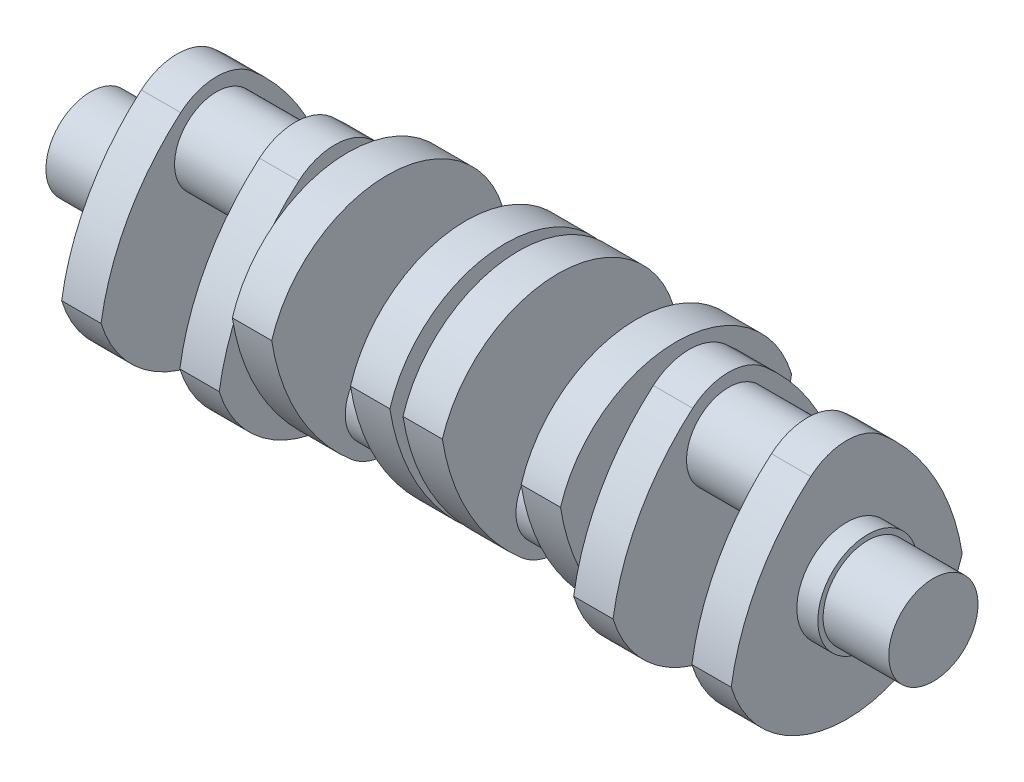
from build123d import *

# Parameters (mm, degrees)
SKETCH1_R            = 17
BOSS_EXTRUDE1_DEPTH  = 25
SKETCH1_6_R          = 19
BOSS_EXTRUDE5_DEPTH  = 8
BOSS_EXTRUDE6_DEPTH  = 15
SKETCH4_R            = 16
BOSS_EXTRUDE7_DEPTH  = 15
BOSS_EXTRUDE8_START  = 5
SKETCH5_R            = 17
BOSS_EXTRUDE8_DEPTH  = 5
BOSS_EXTRUDE9_DEPTH  = 15
SKETCH8_R            = 16
BOSS_EXTRUDE10_DEPTH = 30
BOSS_EXTRUDE11_DEPTH = 15
BOSS_EXTRUDE12_START = 2.5
SKETCH10_R           = 17
BOSS_EXTRUDE12_DEPTH = 2.5


with BuildPart() as part:
    # Sketch1 → Boss-Extrude1 (new body)
    with BuildSketch(Plane(origin=(0, 0, 0), x_dir=(0, 0, -1), z_dir=(1, 0, 0))):
        Circle(SKETCH1_R)
    extrude(amount=-BOSS_EXTRUDE1_DEPTH)

    # Sketch1<6> → Boss-Extrude5 (add)
    with BuildSketch(Plane(origin=(0, 0, 0), x_dir=(0, 0, -1), z_dir=(1, 0, 0))):
        Circle(SKETCH1_6_R)
    extrude(amount=BOSS_EXTRUDE5_DEPTH)

    # Sketch2 → Boss-Extrude6 (add)
    with BuildSketch(Plane(origin=(8, 0, 0), x_dir=(0, 0, -1), z_dir=(1, 0, 0))):
        with BuildLine():
            ThreePointArc((-13.668094758, 40.943123461), (0, 46), (13.668094758, 40.943123461))
            ThreePointArc((13.668094758, 40.943123461), (33.683444249, 16.469257624), (44, -13.416407865))
            ThreePointArc((44, -13.416407865), (0, -46), (-44, -13.416407865))
            ThreePointArc((-44, -13.416407865), (-33.683444249, 16.469257624), (-13.668094758, 40.943123461))
        make_face()
    boss_extrude6 = extrude(amount=BOSS_EXTRUDE6_DEPTH)

    # Sketch4 → Boss-Extrude7 (add)
    with BuildSketch(Plane(origin=(23, 0, 0), x_dir=(0, 0, -1), z_dir=(1, 0, 0))):
        with Locations((0, 25)):
            Circle(SKETCH4_R)
    boss_extrude7 = extrude(amount=BOSS_EXTRUDE7_DEPTH)

    # Mirror1: Boss-Extrude6, Boss-Extrude7 across plane
    add(boss_extrude6.mirror(Plane(origin=(38, 25, 0), x_dir=(0, 0, 1), z_dir=(1, 0, 0))))
    add(boss_extrude7.mirror(Plane(origin=(38, 25, 0), x_dir=(0, 0, 1), z_dir=(1, 0, 0))))

    # Sketch5 → Boss-Extrude8 (add)
    with BuildSketch(Plane(origin=(68, 0, 0), x_dir=(0, 0, -1), z_dir=(1, 0, 0)).offset(BOSS_EXTRUDE8_START)):
        Circle(SKETCH5_R)
    extrude(amount=-BOSS_EXTRUDE8_DEPTH)

    # Sketch7 → Boss-Extrude9 (add)
    with BuildSketch(Plane(origin=(73, 0, 0), x_dir=(0, 0, -1), z_dir=(1, 0, 0))):
        with BuildLine():
            ThreePointArc((-13.668094758, -40.943123461), (0, -46), (13.668094758, -40.943123461))
            ThreePointArc((13.668094758, -40.943123461), (33.683444249, -16.469257624), (44, 13.416407865))
            ThreePointArc((44, 13.416407865), (0, 46), (-44, 13.416407865))
            ThreePointArc((-44, 13.416407865), (-33.683444249, -16.469257624), (-13.668094758, -40.943123461))
        make_face()
    extrude(amount=BOSS_EXTRUDE9_DEPTH)

    # Sketch8 → Boss-Extrude10 (add)
    with BuildSketch(Plane(origin=(88, 0, 0), x_dir=(0, 0, -1), z_dir=(1, 0, 0))):
        with Locations((0, -25)):
            Circle(SKETCH8_R)
    extrude(amount=BOSS_EXTRUDE10_DEPTH)

    # Sketch9 → Boss-Extrude11 (add)
    with BuildSketch(Plane(origin=(118, 0, 0), x_dir=(0, 0, -1), z_dir=(1, 0, 0))):
        with BuildLine():
            ThreePointArc((-13.668094758, -40.943123461), (0, -46), (13.668094758, -40.943123461))
            ThreePointArc((13.668094758, -40.943123461), (33.683444249, -16.469257624), (44, 13.416407865))
            ThreePointArc((44, 13.416407865), (0, 46), (-44, 13.416407865))
            ThreePointArc((-44, 13.416407865), (-33.683444249, -16.469257624), (-13.668094758, -40.943123461))
        make_face()
    extrude(amount=BOSS_EXTRUDE11_DEPTH)

    # Sketch10 → Boss-Extrude12 (add)
    with BuildSketch(Plane(origin=(133, 0, 0), x_dir=(0, 0, -1), z_dir=(1, 0, 0)).offset(BOSS_EXTRUDE12_START)):
        Circle(SKETCH10_R)
    extrude(amount=-BOSS_EXTRUDE12_DEPTH)

    # Mirror2: part across plane


with BuildPart() as part_1:
    add(part.part)
    add(part.part.mirror(Plane(origin=(135.5, 0, 0), x_dir=(0, 0, 1), z_dir=(1, 0, 0))))


solid = part_1.part
